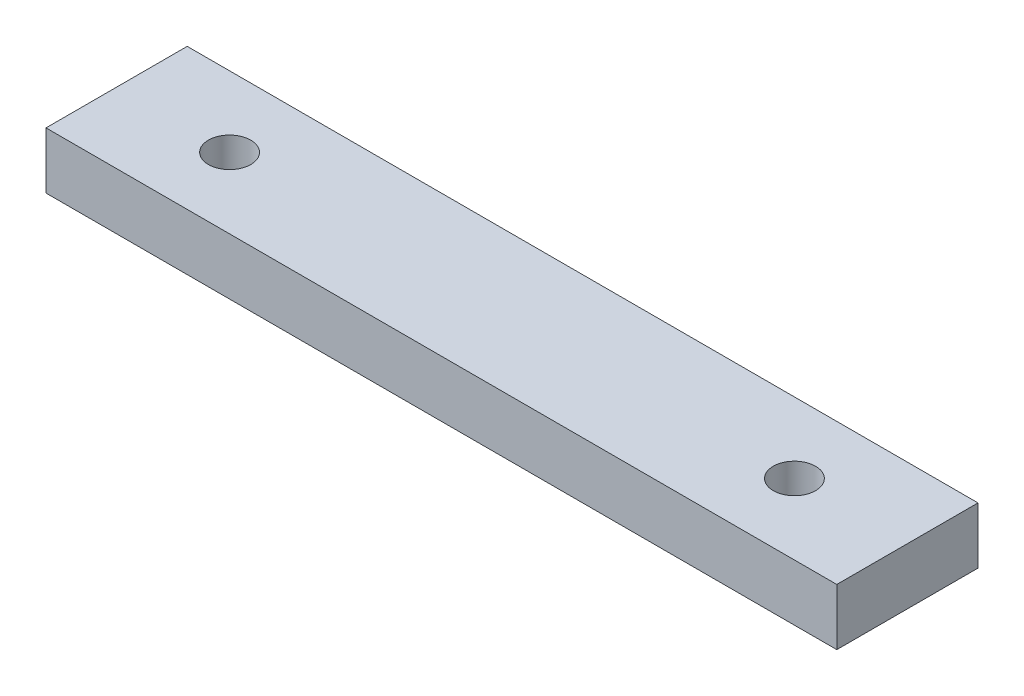
from build123d import *

# Parameters (mm, degrees)
SKETCH1_R           = 1.5
BOSS_EXTRUDE1_DEPTH = 4


with BuildPart() as part:
    # Sketch1 → Boss-Extrude1 (new body)
    with BuildSketch(Plane(origin=(0, 0, 0), x_dir=(1, 0, 0), z_dir=(0, 1, 0))):
        Polygon((-28, 1.089452068), (-28, -8.910547932), (-4.75, -8.910547932), (4.75, -8.910547932), (28, -8.910547932), (28, 1.089452068), (4.75, 1.089452068), (-4.75, 1.089452068), align=None)
        with Locations(Location((-20, -3.910547932, 0), (0, 0, 270))):
            Circle(SKETCH1_R, mode=Mode.SUBTRACT)
        with Locations(Location((20, -3.910547932, 0), (0, 0, 270))):
            Circle(SKETCH1_R, mode=Mode.SUBTRACT)
    extrude(amount=BOSS_EXTRUDE1_DEPTH)


solid = part.part
